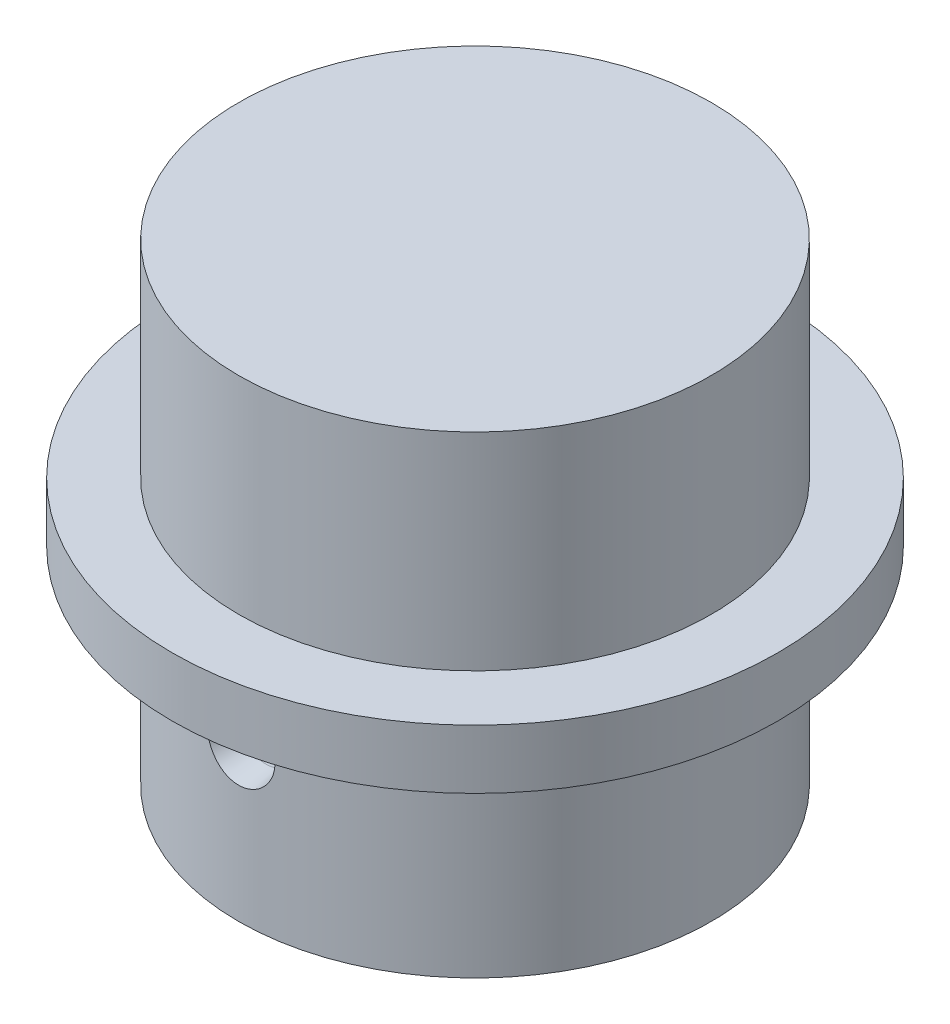
from build123d import *

# Parameters (mm, degrees)
SKETCH1_R          = 16
EXTRUDE1_DEPTH     = 32
SKETCH2_R          = 3.175
EXTRUDE2_DEPTH     = 18.5
SKETCH5_R          = 20.5
EXTRUDE3_DEPTH     = 4
CUT_EXTRUDE1_START = 20
SKETCH6_R          = 2
CUT_EXTRUDE1_DEPTH = 20
CUT_EXTRUDE3_START = 19
SKETCH7_R          = 2.852570135
CUT_EXTRUDE3_DEPTH = 5
CUT_EXTRUDE3_DRAFT = -10


with BuildPart() as part:
    # Sketch1 → Extrude1 (new body)
    with BuildSketch(Plane(origin=(0, 0, 0), x_dir=(1, 0, 0), z_dir=(0, 1, 0))):
        with Locations(Location((0, 0, 0), (0, 0, 270))):
            Circle(SKETCH1_R)
    extrude(amount=EXTRUDE1_DEPTH)

    # Sketch2 → Extrude2 (cut)
    with BuildSketch(Plane.XZ):
        with Locations(Location((0, 0, 0), (0, 0, 270))):
            Circle(SKETCH2_R)
    extrude(amount=-EXTRUDE2_DEPTH, mode=Mode.SUBTRACT)

    # Cut-Sweep1: sweep along a path in Sketch4
    with BuildLine(Plane(origin=(0, 0, 0), x_dir=(1, 0, 0), z_dir=(0, 1, 0))) as cut_sweep1_path:
        CenterArc((0, 0), 11.89136951, 0, 360)
    # Sketch3 → Cut-Sweep1 (sweep, cut)
    with BuildSketch(Plane.XY):
        Polygon((-13.707912963, 0), (-12.662211751, 2.059945265), (-11.108011678, 2.059945265), (-10.062310466, 0), align=None)
    sweep(path=cut_sweep1_path.line, mode=Mode.SUBTRACT)

    # Sketch5 → Extrude3 (add)
    with BuildSketch(Plane.XZ.offset(-14)):
        with Locations(Location((0, 0, 0), (0, 0, 270))):
            Circle(SKETCH5_R)
    extrude(amount=-EXTRUDE3_DEPTH)

    # Sketch6 → Cut-Extrude1 (cut)
    with BuildSketch(Plane.XY.offset(CUT_EXTRUDE1_START)):
        with Locations((0, 10.312515401)):
            Circle(SKETCH6_R)
    extrude(amount=-CUT_EXTRUDE1_DEPTH, mode=Mode.SUBTRACT)


with BuildPart() as cut_extrude3_tool:
    # Sketch7 → Cut-Extrude3 (with draft: the straight prism first)
    with BuildSketch(Plane.XY.offset(CUT_EXTRUDE3_START)):
        with Locations((0, 10.312515401)):
            Circle(SKETCH7_R)
    extrude(amount=-CUT_EXTRUDE3_DEPTH)
    # Cut-Extrude3: the draft: its side faces are tilted about the plane it starts from
    cut_extrude3_sides = [cut_extrude3_tool.faces().sort_by_distance(p)[0] for p in [
        (-2.852570135, 10.312515401, 16.5),
    ]]
    draft(cut_extrude3_sides, Plane.XY.offset(CUT_EXTRUDE3_START), CUT_EXTRUDE3_DRAFT)


with BuildPart() as part_1:
    add(part.part)

    # Cut-Extrude3: cut by cut_extrude3_tool
    add(cut_extrude3_tool.part, mode=Mode.SUBTRACT)


solid = part_1.part
